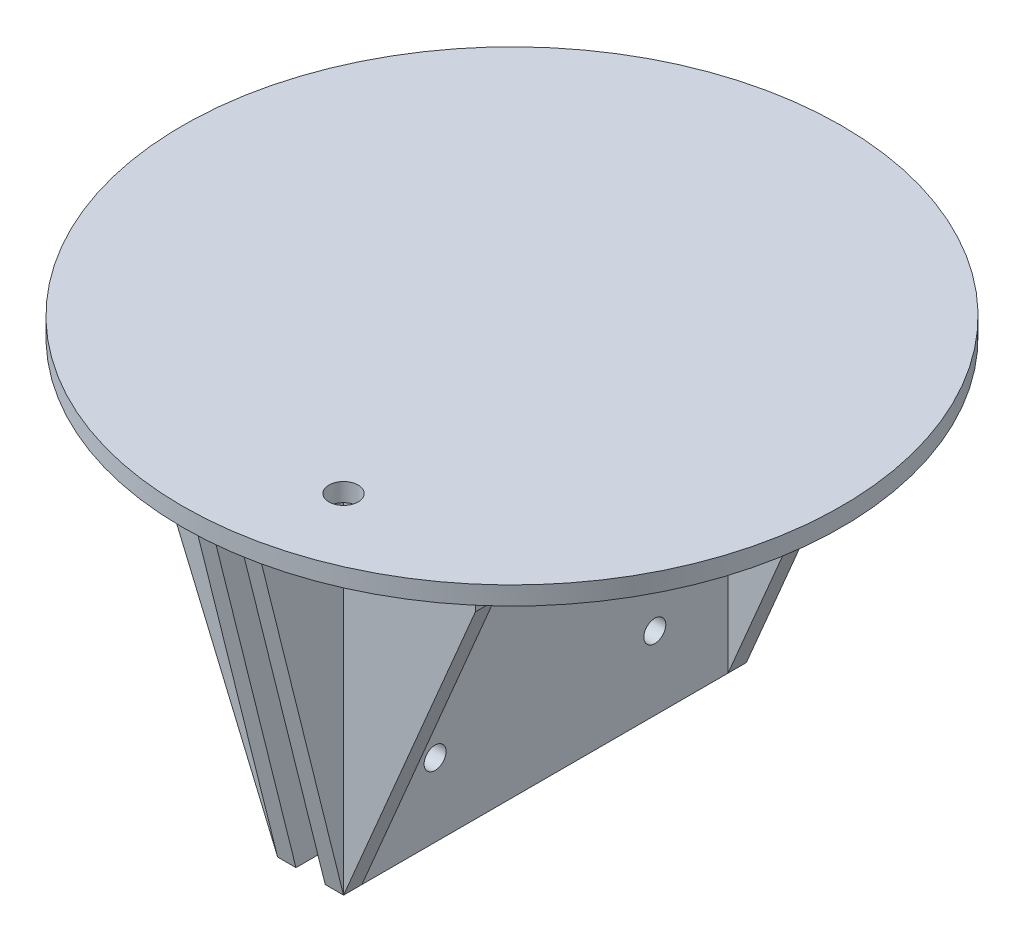
from build123d import *

# Parameters (mm, degrees)
SKETCH1_R            = 90
BOSS_EXTRUDE1_DEPTH  = 5
SKETCH2_W            = 90
SKETCH2_H            = 5
BOSS_EXTRUDE2_DEPTH  = 100
CUT_EXTRUDE1_DEPTH   = 100
SKETCH4_W            = 8
SKETCH4_H            = 50
CUT_EXTRUDE2_DEPTH   = 198.800404449
MIRROR2_COPY_1_DEPTH = 100
SKETCH5_W            = 5
SKETCH5_H            = 100
BOSS_EXTRUDE3_DEPTH  = 100
BOSS_EXTRUDE4_DEPTH  = 2.5
MIRROR5_COPY_1_DEPTH = 2.5
SKETCH7_R            = 3
CUT_EXTRUDE3_DEPTH   = 168.03592428
SKETCH8_R            = 4
CUT_EXTRUDE4_DEPTH   = 162.864140562


with BuildPart() as part:
    # Sketch1 → Boss-Extrude1 (new body)
    with BuildSketch(Plane(origin=(0, 0, 0), x_dir=(1, 0, 0), z_dir=(0, 1, 0))):
        with Locations(Location((0, 0, 0), (0, 0, 270))):
            Circle(SKETCH1_R)
    extrude(amount=BOSS_EXTRUDE1_DEPTH)

    # Sketch2 → Boss-Extrude2 (add)
    with BuildSketch(Plane(origin=(0, 0, 0), x_dir=(-1, 0, 0), z_dir=(0, -1, 0))):
        with Locations((0, -52.5)):
            Rectangle(SKETCH2_W, SKETCH2_H)
    boss_extrude2 = extrude(amount=BOSS_EXTRUDE2_DEPTH)

    # Sketch3 → Cut-Extrude1 (cut)
    with BuildSketch(Plane.XY.offset(55)):
        Polygon((45, -15), (9, -100), (45, -100), align=None)
    cut_extrude1 = extrude(amount=-CUT_EXTRUDE1_DEPTH, mode=Mode.SUBTRACT)

    # Mirror1: Cut-Extrude1 across plane
    add(cut_extrude1.mirror(Plane(origin=(0, 0, 0), x_dir=(0, 0, 1), z_dir=(1, 0, 0))), mode=Mode.SUBTRACT)

    # Sketch4 → Cut-Extrude2 (cut, through all)
    with BuildSketch(Plane.XY.offset(55)):
        with Locations((0, -75)):
            Rectangle(SKETCH4_W, SKETCH4_H)
    cut_extrude2 = extrude(amount=-CUT_EXTRUDE2_DEPTH, mode=Mode.SUBTRACT)

    # Mirror2: Boss-Extrude2, Cut-Extrude1, Cut-Extrude2 across plane
    add(boss_extrude2.mirror(Plane.XY))
    add(cut_extrude1.mirror(Plane.XY), mode=Mode.SUBTRACT)
    add(cut_extrude2.mirror(Plane.XY), mode=Mode.SUBTRACT)

    # Mirror2 copy 1 sketch → Mirror2 copy 1 (cut)
    with BuildSketch(Plane(origin=(0, 0, -55), x_dir=(-1, 0, 0), z_dir=(0, 0, -1))):
        Polygon((45, -15), (9, -100), (45, -100), align=None)
    extrude(amount=-MIRROR2_COPY_1_DEPTH, mode=Mode.SUBTRACT)

    # Sketch5 → Boss-Extrude3 (add)
    with BuildSketch(Plane.XZ):
        with Locations((-6.5, 0)):
            Rectangle(SKETCH5_W, SKETCH5_H)
    boss_extrude3 = extrude(amount=BOSS_EXTRUDE3_DEPTH)

    # Mirror3: Boss-Extrude3 across plane
    add(boss_extrude3.mirror(Plane(origin=(0, 0, 0), x_dir=(0, 0, 1), z_dir=(1, 0, 0))))

    # Sketch6 → Boss-Extrude4 (add, symmetric)
    with BuildSketch(Plane(origin=(-6.5, 0, 0), x_dir=(0, 0, -1), z_dir=(1, 0, 0))):
        Polygon((-55, -100), (-55, 0), (-80, 0), align=None)
    boss_extrude4 = extrude(amount=BOSS_EXTRUDE4_DEPTH, both=True)

    # Mirror4: Boss-Extrude4 across plane
    add(boss_extrude4.mirror(Plane(origin=(0, 0, 0), x_dir=(0, 0, 1), z_dir=(1, 0, 0))))

    # Mirror5: Boss-Extrude4 across plane
    add(boss_extrude4.mirror(Plane.XY))

    # Mirror5 copy 1 sketch → Mirror5 copy 1 (add, symmetric)
    with BuildSketch(Plane.ZY.offset(-6.5)):
        Polygon((-55, -100), (-55, 0), (-80, 0), align=None)
    extrude(amount=MIRROR5_COPY_1_DEPTH, both=True)

    # Sketch7 → Cut-Extrude3 (cut, through all)
    with BuildSketch(Plane(origin=(9, 0, 0), x_dir=(0, 0, -1), z_dir=(1, 0, 0))):
        with Locations((-30, -80)):
            Circle(SKETCH7_R)
    cut_extrude3 = extrude(amount=-CUT_EXTRUDE3_DEPTH, mode=Mode.SUBTRACT)

    # Mirror6: Cut-Extrude3 across plane
    add(cut_extrude3.mirror(Plane.XY), mode=Mode.SUBTRACT)

    # Sketch8 → Cut-Extrude4 (cut, through all)
    with BuildSketch(Plane.XZ):
        with Locations(Location((19, 65, 0), (0, 0, 270))):
            Circle(SKETCH8_R)
    extrude(amount=-CUT_EXTRUDE4_DEPTH, mode=Mode.SUBTRACT)


solid = part.part
